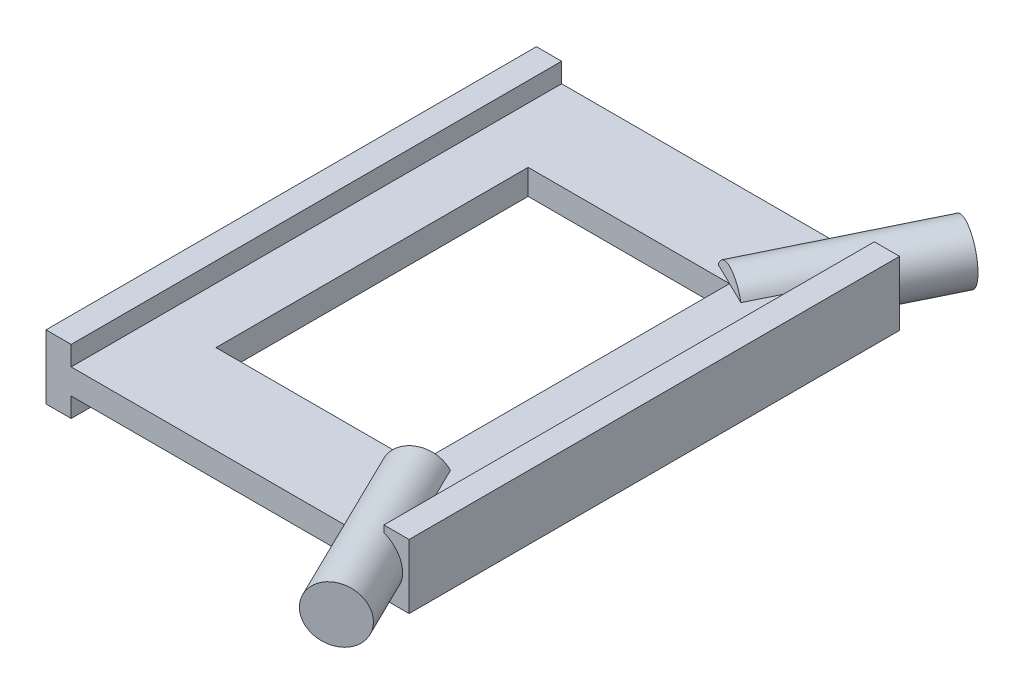
from build123d import *

# Parameters (mm, degrees)
SKETCH1_W               = 72.11
SKETCH1_H               = 97.4
BOSS_EXTRUDE1_DEPTH     = 2.5
SKETCH2_W               = 5
SKETCH2_H               = 97.4
BOSS_EXTRUDE2_DEPTH     = 6.375
CUT_EXTRUDE1_DEPTH      = 62.240661737
CUT_EXTRUDE1_DEPTH_BACK = 62.240661737
SKETCH3_W               = 40
SKETCH3_H               = 62


with BuildPart() as part:
    # Sketch1 → Boss-Extrude1 (new, symmetric)
    with BuildSketch(Plane(origin=(0, 0, 0), x_dir=(1, 0, 0), z_dir=(0, 1, 0))):
        Rectangle(SKETCH1_W, SKETCH1_H)
    extrude(amount=BOSS_EXTRUDE1_DEPTH, both=True)

    # Sketch2 → Boss-Extrude2 (add, symmetric)
    with BuildSketch(Plane(origin=(0, 0, 0), x_dir=(1, 0, 0), z_dir=(0, 1, 0))):
        with Locations((-33.555, 0)):
            Rectangle(SKETCH2_W, SKETCH2_H)
        with Locations((33.555, 0)):
            Rectangle(SKETCH2_W, SKETCH2_H)
    extrude(amount=BOSS_EXTRUDE2_DEPTH, both=True)

    # Sketch3 → Cut-Extrude1 (cut, two sides: drawn at the far end of the back side and taken through both)
    with BuildSketch(Plane(origin=(0, 2.5, 0), x_dir=(1, 0, 0), z_dir=(0, 1, 0)).offset(-CUT_EXTRUDE1_DEPTH_BACK)):
        Rectangle(SKETCH3_W, SKETCH3_H)
    extrude(amount=CUT_EXTRUDE1_DEPTH + CUT_EXTRUDE1_DEPTH_BACK, mode=Mode.SUBTRACT)

    # Sketch4 → Revolve1 (revolve)
    with BuildSketch(Plane(origin=(0, 0, 0), x_dir=(1, 0, 0), z_dir=(0, 1, 0)), mode=Mode.PRIVATE) as revolve1_sk:
        Polygon((20, 31), (15.058430503, 33.414723774), (30.424854519, 64.86107512), (35.366424016, 62.446351346), align=None)
    revolve1 = revolve(revolve1_sk.sketch.rotate(Axis((20, 0, -31), (0.4390406861851917, 0, -0.8984671813004836)), 180), axis=Axis((20, 0, -31), (0.4390406861851917, 0, -0.8984671813004836)))

    # Mirror1: Revolve1 across plane
    add(revolve1.mirror(Plane.XY))


solid = part.part
